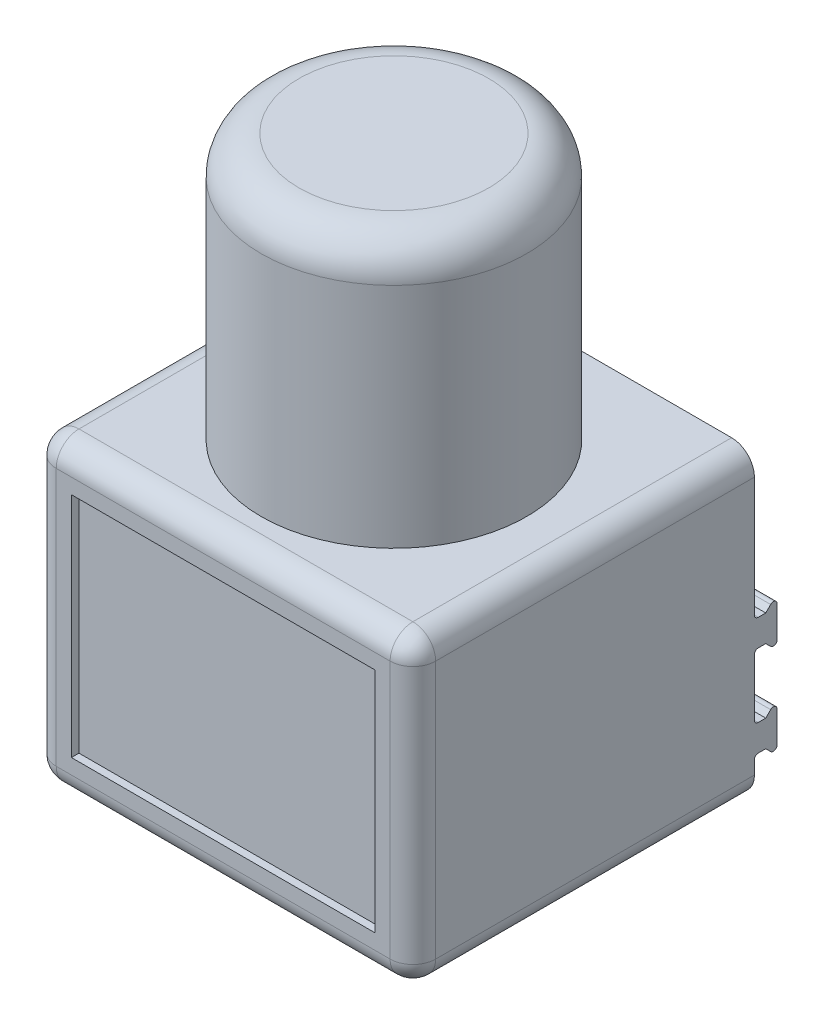
from build123d import *

# Parameters (mm, degrees)
SKETCH1_W           = 500
SKETCH1_H           = 450
BOSS_EXTRUDE1_DEPTH = 200
BOSS_EXTRUDE2_DEPTH = 500
FILLET1_R           = 5
SKETCH3_R           = 150
CUT_EXTRUDE1_DEPTH  = 200
SKETCH4_R           = 175
BOSS_EXTRUDE3_DEPTH = 350
FILLET2_R           = 50
FILLET3_R           = 30
SKETCH5_W           = 400
SKETCH5_H           = 300
CUT_EXTRUDE2_DEPTH  = 10


with BuildPart() as part:
    # Sketch1 → Boss-Extrude1 (new, symmetric)
    with BuildSketch(Plane(origin=(0, 0, 0), x_dir=(1, 0, 0), z_dir=(0, 1, 0))):
        Rectangle(SKETCH1_W, SKETCH1_H)
    extrude(amount=BOSS_EXTRUDE1_DEPTH, both=True)

    # Sketch2 → Boss-Extrude2 (add)
    with BuildSketch(Plane(origin=(250, 0, 0), x_dir=(0, 0, -1), z_dir=(1, 0, 0))):
        Polygon((240, -27.5), (255, -42.5), (255, 22.5), (240, 7.5), (225, 7.5), (225, -27.5), align=None)
        Polygon((225, -147.5), (225, -112.5), (240, -112.5), (255, -97.5), (255, -162.5), (240, -147.5), align=None)
    extrude(amount=-BOSS_EXTRUDE2_DEPTH)

    # Fillet1
    fillet1_edges = [part.edges().sort_by_distance(p)[0] for p in [
        (0, -147.5, -225),
        (0, -112.5, -225),
        (0, -97.5, -255),
        (0, -162.5, -255),
        (0, -27.5, -225),
        (0, 7.5, -225),
        (0, 22.5, -255),
        (0, -42.5, -255),
    ]]
    fillet(fillet1_edges, radius=FILLET1_R)

    # Sketch3 → Cut-Extrude1 (cut)
    with BuildSketch(Plane.XZ.offset(200)):
        with Locations(Location((0, 0, 0), (0, 0, 270))):
            Circle(SKETCH3_R)
    extrude(amount=-CUT_EXTRUDE1_DEPTH, mode=Mode.SUBTRACT)

    # Sketch4 → Boss-Extrude3 (add)
    with BuildSketch(Plane(origin=(0, 200, 0), x_dir=(1, 0, 0), z_dir=(0, 1, 0))):
        with Locations(Location((0, 0, 0), (0, 0, 270))):
            Circle(SKETCH4_R)
    extrude(amount=BOSS_EXTRUDE3_DEPTH)

    # Fillet2
    fillet2_edges = [part.edges().sort_by_distance(p)[0] for p in [
        (0, 550, -175),
    ]]
    fillet(fillet2_edges, radius=FILLET2_R)

    # Fillet3
    fillet3_edges = [part.edges().sort_by_distance(p)[0] for p in [
        (-250, 200, 0),
        (0, 200, 225),
        (250, 200, 0),
        (0, -200, 225),
        (-250, -200, 0),
        (250, -200, 0),
        (250, 0, 225),
        (-250, 0, 225),
    ]]
    fillet(fillet3_edges, radius=FILLET3_R)

    # Sketch5 → Cut-Extrude2 (cut)
    with BuildSketch(Plane.XY.offset(225)):
        Rectangle(SKETCH5_W, SKETCH5_H)
    extrude(amount=-CUT_EXTRUDE2_DEPTH, mode=Mode.SUBTRACT)


solid = part.part
